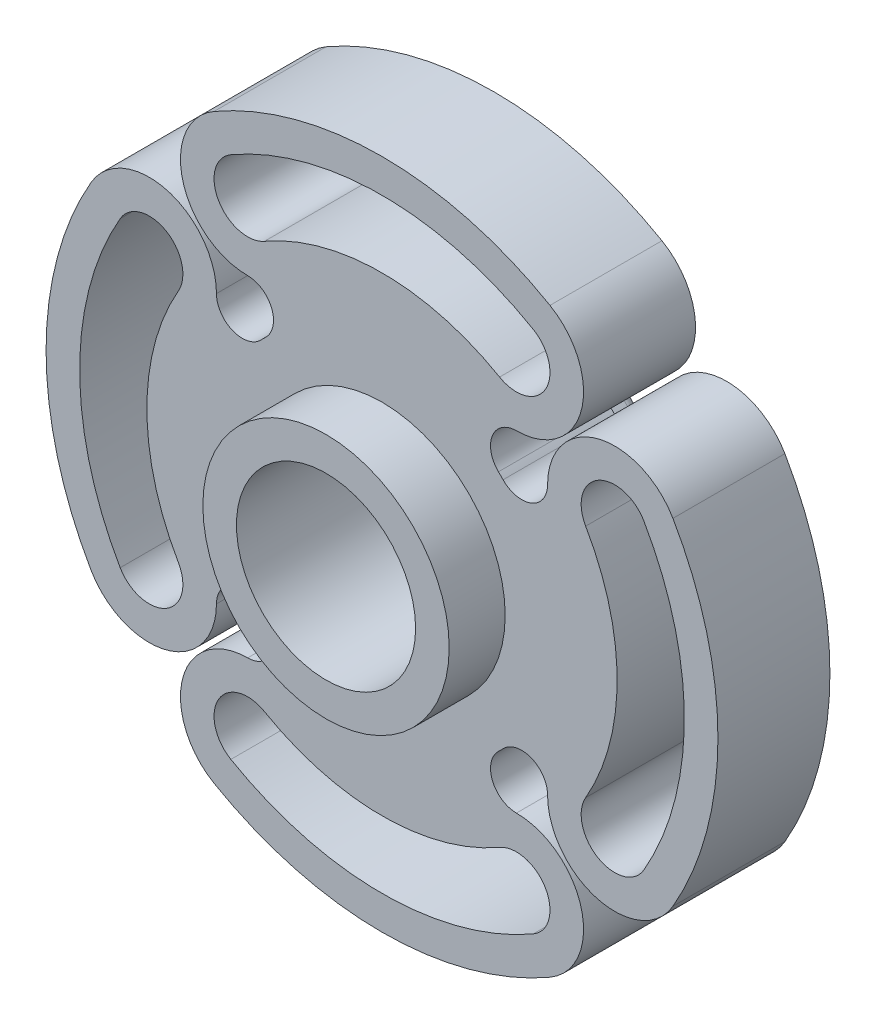
from build123d import *

# Parameters (mm, degrees)
SKETCH1_R           = 11
SKETCH1_R_2         = 8
BOSS_EXTRUDE1_DEPTH = 10
SKETCH1_5_R         = 11
BOSS_EXTRUDE3_DEPTH = 5
FILLET2_R           = 1
FILLET3_R           = 1


with BuildPart() as part:
    # Sketch1 → Boss-Extrude1 (new, symmetric)
    with BuildSketch(Plane.XY):
        Circle(SKETCH1_R)
        Circle(SKETCH1_R_2, mode=Mode.SUBTRACT)
    extrude(amount=BOSS_EXTRUDE1_DEPTH, both=True)

    # Sketch1<5> → Boss-Extrude3 (add, symmetric)
    with BuildSketch(Plane.XY):
        with BuildLine():
            ThreePointArc((-12, 14.784609691), (-9.857677434, 13.338075004), (-10.398817362, 10.810393031))
            ThreePointArc((-10.398817362, 10.810393031), (-10.606601718, 10.606601718), (-10.810393031, 10.398817362))
            ThreePointArc((-10.810393031, 10.398817362), (-13.338075004, 9.857677434), (-14.784609691, 12))
            ThreePointArc((-14.784609691, 12), (-19.23169542, 17.795554958), (-25.980762114, 15))
            ThreePointArc((-25.980762114, 15), (-30, 0), (-25.980762114, -15))
            ThreePointArc((-25.980762114, -15), (-19.23169542, -17.795554958), (-14.784609691, -12))
            ThreePointArc((-14.784609691, -12), (-13.338075004, -9.857677434), (-10.810393031, -10.398817362))
            ThreePointArc((-10.810393031, -10.398817362), (-10.606601718, -10.606601718), (-10.398817362, -10.810393031))
            ThreePointArc((-10.398817362, -10.810393031), (-9.857677434, -13.338075004), (-12, -14.784609691))
            ThreePointArc((-12, -14.784609691), (-17.795554958, -19.23169542), (-15, -25.980762114))
            ThreePointArc((-15, -25.980762114), (0, -30), (15, -25.980762114))
            ThreePointArc((15, -25.980762114), (17.795554958, -19.23169542), (12, -14.784609691))
            ThreePointArc((12, -14.784609691), (9.857677434, -13.338075004), (10.398817362, -10.810393031))
            ThreePointArc((10.398817362, -10.810393031), (10.606601718, -10.606601718), (10.810393031, -10.398817362))
            ThreePointArc((10.810393031, -10.398817362), (13.338075004, -9.857677434), (14.784609691, -12))
            ThreePointArc((14.784609691, -12), (19.23169542, -17.795554958), (25.980762114, -15))
            ThreePointArc((25.980762114, -15), (30, 0), (25.980762114, 15))
            ThreePointArc((25.980762114, 15), (19.23169542, 17.795554958), (14.784609691, 12))
            ThreePointArc((14.784609691, 12), (13.338075004, 9.857677434), (10.810393031, 10.398817362))
            ThreePointArc((10.810393031, 10.398817362), (10.606601718, 10.606601718), (10.398817362, 10.810393031))
            ThreePointArc((10.398817362, 10.810393031), (9.857677434, 13.338075004), (12, 14.784609691))
            ThreePointArc((12, 14.784609691), (17.795554958, 19.23169542), (15, 25.980762114))
            ThreePointArc((15, 25.980762114), (0, 30), (-15, 25.980762114))
            ThreePointArc((-15, 25.980762114), (-17.795554958, 19.23169542), (-12, 14.784609691))
        make_face()
        with BuildLine():
            ThreePointArc((13.5, -23.382685902), (0, -27), (-13.5, -23.382685902))
            ThreePointArc((-13.5, -23.382685902), (-14.598076211, -19.284609691), (-10.5, -18.186533479))
            ThreePointArc((-10.5, -18.186533479), (0, -21), (10.5, -18.186533479))
            ThreePointArc((10.5, -18.186533479), (14.598076211, -19.284609691), (13.5, -23.382685902))
        make_face(mode=Mode.SUBTRACT)
        Circle(SKETCH1_5_R, mode=Mode.SUBTRACT)
        with BuildLine():
            ThreePointArc((23.382685902, 13.5), (27, 0), (23.382685902, -13.5))
            ThreePointArc((23.382685902, -13.5), (19.284609691, -14.598076211), (18.186533479, -10.5))
            ThreePointArc((18.186533479, -10.5), (21, 0), (18.186533479, 10.5))
            ThreePointArc((18.186533479, 10.5), (19.284609691, 14.598076211), (23.382685902, 13.5))
        make_face(mode=Mode.SUBTRACT)
        with BuildLine():
            ThreePointArc((-23.382685902, -13.5), (-27, 0), (-23.382685902, 13.5))
            ThreePointArc((-23.382685902, 13.5), (-19.284609691, 14.598076211), (-18.186533479, 10.5))
            ThreePointArc((-18.186533479, 10.5), (-21, 0), (-18.186533479, -10.5))
            ThreePointArc((-18.186533479, -10.5), (-19.284609691, -14.598076211), (-23.382685902, -13.5))
        make_face(mode=Mode.SUBTRACT)
        with BuildLine():
            ThreePointArc((-13.5, 23.382685902), (0, 27), (13.5, 23.382685902))
            ThreePointArc((13.5, 23.382685902), (14.598076211, 19.284609691), (10.5, 18.186533479))
            ThreePointArc((10.5, 18.186533479), (0, 21), (-10.5, 18.186533479))
            ThreePointArc((-10.5, 18.186533479), (-14.598076211, 19.284609691), (-13.5, 23.382685902))
        make_face(mode=Mode.SUBTRACT)
    extrude(amount=BOSS_EXTRUDE3_DEPTH, both=True)

    # Fillet2
    fillet2_edges = [part.edges().sort_by_distance(p)[0] for p in [
        (-8, 0, -10),
        (-11, 0, -10),
    ]]
    fillet(fillet2_edges, radius=FILLET2_R)

    # Fillet3
    fillet3_edges = [part.edges().sort_by_distance(p)[0] for p in [
        (-11, 0, -5),
    ]]
    fillet(fillet3_edges, radius=FILLET3_R)


solid = part.part
